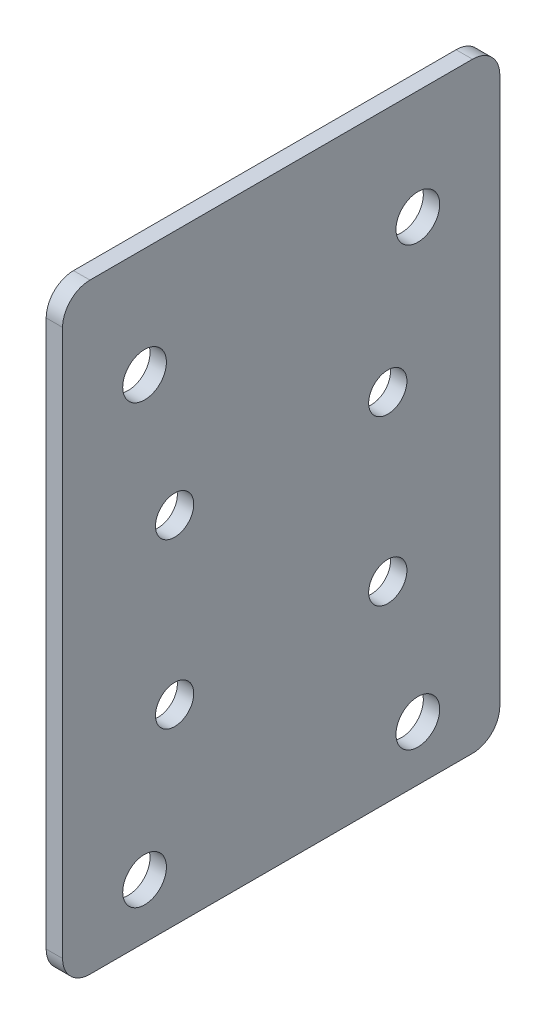
from build123d import *

# Parameters (mm, degrees)
BOSS_EXTRUDE1_DEPTH = 40
SKETCH16_R          = 3.5
CUT_EXTRUDE5_DEPTH  = 96.547228328
SKETCH17_R          = 4
CUT_EXTRUDE7_DEPTH  = 96.547228328
FILLET1_R           = 5


with BuildPart() as part:
    # Sketch1 → Boss-Extrude1 (new, symmetric)
    with BuildSketch(Plane.XY):
        Polygon((0, -23.280493307), (0, 86.719506693), (3, 86.719506693), (3, 83.719506693), (3, -23.280493307), align=None)
    extrude(amount=BOSS_EXTRUDE1_DEPTH, both=True)

    # Sketch16 → Cut-Extrude5 (cut, through all)
    with BuildSketch(Plane(origin=(3, 0, 0), x_dir=(0, 0, -1), z_dir=(1, 0, 0))):
        with Locations((-19.5, 11.719506693)):
            Circle(SKETCH16_R)
        with Locations((19.5, 11.719506693)):
            Circle(SKETCH16_R)
        with Locations((19.5, 41.719506693)):
            Circle(SKETCH16_R)
        with Locations((-19.5, 41.719506693)):
            Circle(SKETCH16_R)
    extrude(amount=-CUT_EXTRUDE5_DEPTH, mode=Mode.SUBTRACT)

    # Sketch17 → Cut-Extrude7 (cut, through all)
    with BuildSketch(Plane.ZY):
        with Locations((-25, 66.719506693)):
            Circle(SKETCH17_R)
        with Locations((24.997500187, 66.719506693)):
            Circle(SKETCH17_R)
        with Locations((-25, -13.280493307)):
            Circle(SKETCH17_R)
        with Locations((24.997500187, -13.280493307)):
            Circle(SKETCH17_R)
    extrude(amount=-CUT_EXTRUDE7_DEPTH, mode=Mode.SUBTRACT)

    # Fillet1
    fillet1_edges = [part.edges().sort_by_distance(p)[0] for p in [
        (1.5, 86.719506693, 40),
        (1.5, -23.280493307, 40),
        (1.5, 86.719506693, -40),
        (1.5, -23.280493307, -40),
    ]]
    fillet(fillet1_edges, radius=FILLET1_R)


solid = part.part
